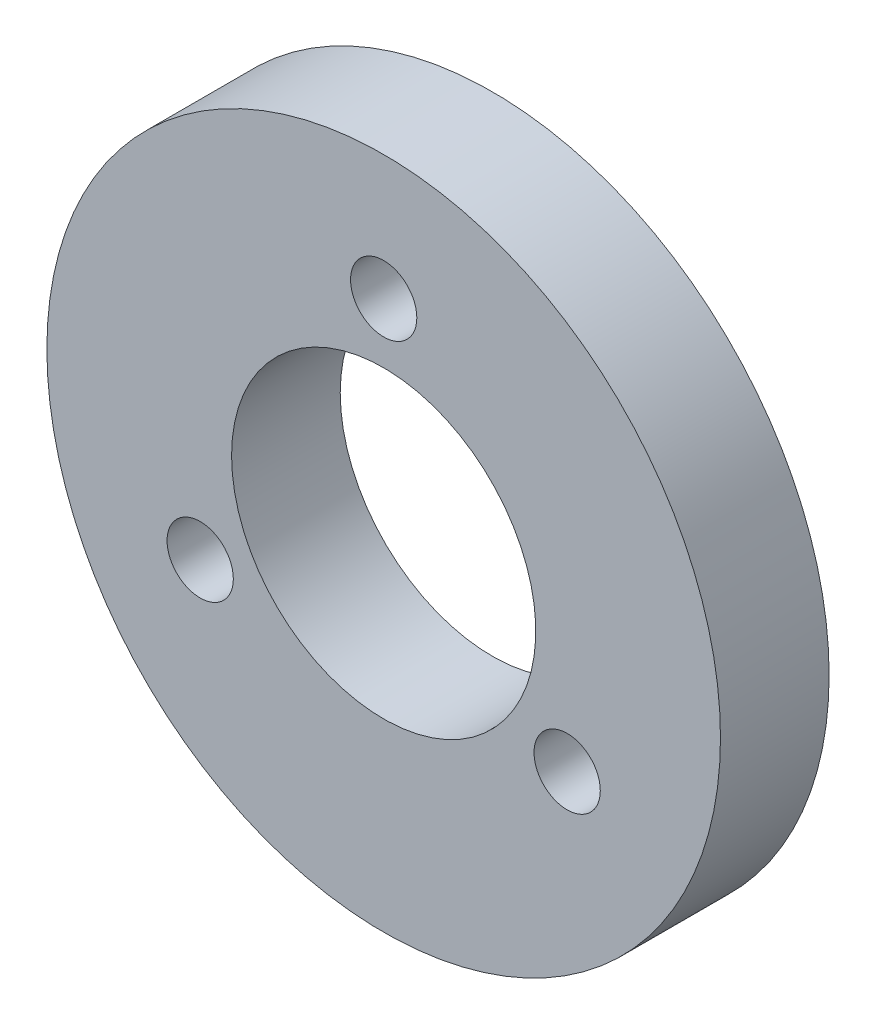
from build123d import *

# Parameters (mm, degrees)
SKETCH1_R           = 15.5
SKETCH1_R_2         = 7
BOSS_EXTRUDE1_DEPTH = 5
CUT_EXTRUDE1_REACH  = 24.483
SKETCH2_R           = 1.525


with BuildPart() as part:
    # Sketch1 → Boss-Extrude1 (new body)
    with BuildSketch(Plane.XY):
        Circle(SKETCH1_R)
        Circle(SKETCH1_R_2, mode=Mode.SUBTRACT)
    extrude(amount=BOSS_EXTRUDE1_DEPTH)

    # Sketch2 → Cut-Extrude1 (cut, up to next)
    with BuildSketch(Plane.XY.offset(5), mode=Mode.PRIVATE) as cut_extrude1_sk1:
        with Locations((0, 9.75)):
            Circle(SKETCH2_R)
    cut_extrude1_tool1 = extrude(cut_extrude1_sk1.sketch, amount=-CUT_EXTRUDE1_REACH, mode=Mode.PRIVATE) & part.part
    # Sketch2 → Cut-Extrude1 (cut, up to next)
    with BuildSketch(Plane.XY.offset(5), mode=Mode.PRIVATE) as cut_extrude1_sk2:
        with Locations((8.443747687, -4.875)):
            Circle(SKETCH2_R)
    cut_extrude1_tool2 = extrude(cut_extrude1_sk2.sketch, amount=-CUT_EXTRUDE1_REACH, mode=Mode.PRIVATE) & part.part
    # Sketch2 → Cut-Extrude1 (cut, up to next)
    with BuildSketch(Plane.XY.offset(5), mode=Mode.PRIVATE) as cut_extrude1_sk3:
        with Locations((-8.443747687, -4.875)):
            Circle(SKETCH2_R)
    cut_extrude1_tool3 = extrude(cut_extrude1_sk3.sketch, amount=-CUT_EXTRUDE1_REACH, mode=Mode.PRIVATE) & part.part
    add(cut_extrude1_tool1.solids().sort_by_distance((0, 9.75, 5))[0], mode=Mode.SUBTRACT)
    add(cut_extrude1_tool2.solids().sort_by_distance((8.443748, -4.875, 5))[0], mode=Mode.SUBTRACT)
    add(cut_extrude1_tool3.solids().sort_by_distance((-8.443748, -4.875, 5))[0], mode=Mode.SUBTRACT)


solid = part.part
